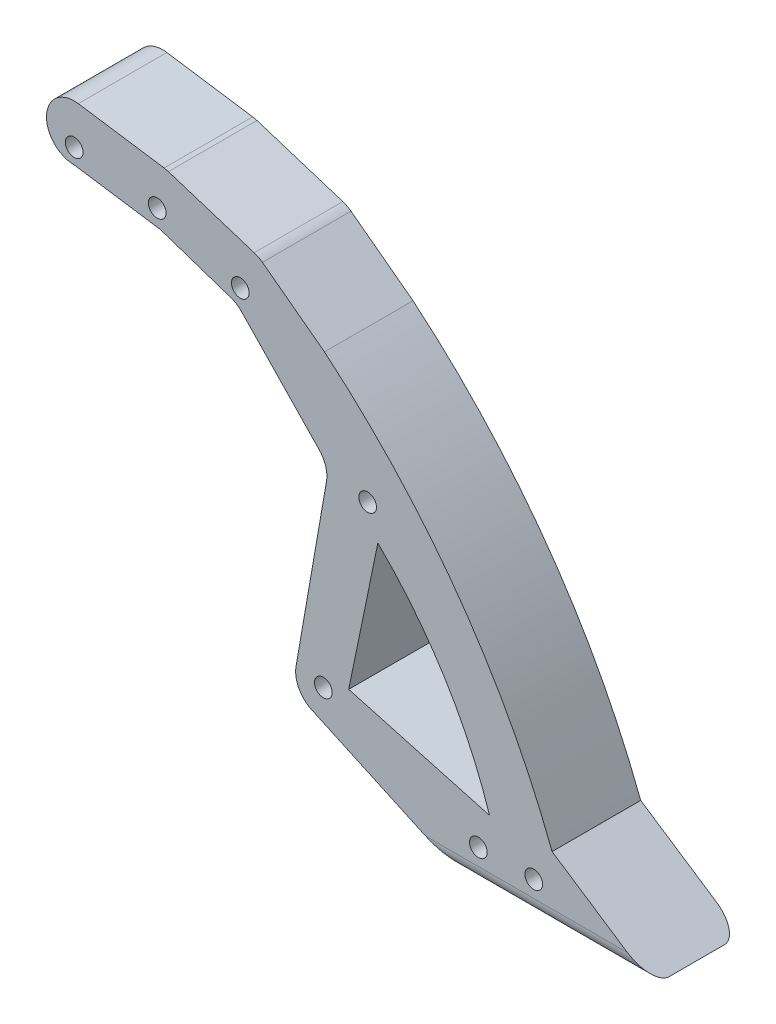
from build123d import *

# Parameters (mm, degrees)
SKETCH1_R           = 1.6
BOSS_EXTRUDE1_DEPTH = 16
FILLET1_R           = 3
FILLET2_R           = 5
CUT_EXTRUDE1_START  = -5.5
SKETCH2_R           = 2.1
SKETCH2_R_2         = 1.6
CUT_EXTRUDE1_DEPTH  = 5
CUT_EXTRUDE2_START  = -4
SKETCH2_4_R         = 1.6
CUT_EXTRUDE2_DEPTH  = 8
FILLET3_R           = 1


with BuildPart() as part:
    # Sketch1 → Boss-Extrude1 (new body)
    with BuildSketch(Plane.XY):
        with BuildLine():
            Line((59.46, -17), (41.32, -5))
            ThreePointArc((41.32, -5), (24.459745553, 26.441207242), (0.2, 52.6))
            Line((0.2, 52.6), (-11, 61))
            ThreePointArc((-11, 61), (-11.709245402, 61.444372101), (-12.482677345, 61.764213677))
            Line((-12.482677345, 61.764213677), (-27.982677345, 66.70070535))
            Line((-27.982677345, 66.70070535), (-28.761883628, 66.881709992))
            Line((-28.761883628, 66.881709992), (-44.261883628, 69.195218319))
            ThreePointArc((-44.261883628, 69.195218319), (-49.986285772, 64.62007324), (-45, 59.25))
            Line((-45, 59.25), (-29.5, 56.936491673))
            Line((-29.5, 56.936491673), (-15.593484906, 52.260716736))
            Line((-15.593484906, 52.260716736), (1, 35))
            Line((1, 35), (-4.926348457, 0.855038527))
            ThreePointArc((-4.926348457, 0.855038527), (-4.425801292, -2.326431372), (-2.089024899, -4.542683675))
            Line((-2.089024899, -4.542683675), (25, -17))
            Line((25, -17), (59.46, -17))
        make_face()
        with Locations((28, -11)):
            Circle(SKETCH1_R, mode=Mode.SUBTRACT)
        with Locations((38, -11)):
            Circle(SKETCH1_R, mode=Mode.SUBTRACT)
        with BuildLine():
            Line((30.019916022, -5), (4.581128304, 2.00331312))
            Line((4.581128304, 2.00331312), (9.851129428, 27.519340358))
            ThreePointArc((9.851129428, 27.519340358), (21.90850327, 12.483330411), (30.019916022, -5))
        make_face(mode=Mode.SUBTRACT)
        with Locations((-45, 62)):
            Circle(SKETCH1_R, mode=Mode.SUBTRACT)
        with Locations((-30, 60)):
            Circle(SKETCH1_R, mode=Mode.SUBTRACT)
        with Locations((-15, 55)):
            Circle(SKETCH1_R, mode=Mode.SUBTRACT)
        with Locations((8, 33)):
            Circle(SKETCH1_R, mode=Mode.SUBTRACT)
        Circle(SKETCH1_R, mode=Mode.SUBTRACT)
    extrude(amount=BOSS_EXTRUDE1_DEPTH)

    # Fillet1
    fillet1_edges = [part.edges().sort_by_distance(p)[0] for p in [
        (42.23, -17, 0),
        (42.23, -17, 16),
    ]]
    fillet(fillet1_edges, radius=FILLET1_R)

    # Fillet2
    fillet2_edges = [part.edges().sort_by_distance(p)[0] for p in [
        (1, 35, 8),
        (-15.593484906, 52.260716736, 8),
        (-29.5, 56.936491673, 8),
    ]]
    fillet(fillet2_edges, radius=FILLET2_R)

    # Sketch2 → Cut-Extrude1 (cut)
    # profile 1 of 3: a face of its own
    with BuildSketch(Plane.XY.offset(16).offset(CUT_EXTRUDE1_START)):
        with BuildLine():
            Line((-23.499613929, 54.918987315), (-16.755150829, 52.651302614))
            ThreePointArc((-16.755150829, 52.651302614), (-15.672698928, 52.135686265), (-14.744120066, 51.377198536))
            Line((-14.744120066, 51.377198536), (-10, 46.442315172))
            Line((-10, 46.442315172), (-10, 55))
            ThreePointArc((-10, 55), (-12.752546223, 59.466424915), (-17.979580608, 59.015233418))
            Line((-17.979580608, 59.015233418), (-23.499613929, 54.918987315))
        make_face()
        with Locations((-15, 55)):
            Circle(SKETCH2_R, mode=Mode.SUBTRACT)
    # profile 2 of 3: a face of its own
    with BuildSketch(Plane.XY.offset(16).offset(CUT_EXTRUDE1_START)):
        with BuildLine():
            Line((-23.499613929, 54.918987315), (-25.163326304, 61.267512349))
            ThreePointArc((-25.163326304, 61.267512349), (-28.762198184, 64.844362359), (-33.635794756, 63.432345625))
            Line((-33.635794756, 63.432345625), (-38.5, 58.279819089))
            Line((-38.5, 58.279819089), (-29.936778714, 57.001684653))
            ThreePointArc((-29.936778714, 57.001684653), (-29.504556057, 56.917567707), (-29.081410179, 56.795749598))
            Line((-29.081410179, 56.795749598), (-23.499613929, 54.918987315))
        make_face()
        with Locations((-30, 60)):
            Circle(SKETCH2_R_2, mode=Mode.SUBTRACT)
    # profile 3 of 3: a face of its own
    with BuildSketch(Plane.XY.offset(16).offset(CUT_EXTRUDE1_START)):
        with BuildLine():
            Line((-38.5, 58.279819089), (-40.253762465, 63.572650394))
            ThreePointArc((-40.253762465, 63.572650394), (-45.2324625, 66.994593195), (-49.871793817, 63.125))
            ThreePointArc((-49.871793817, 63.125), (-48.112474899, 60.336881039), (-45, 59.25))
            Line((-45, 59.25), (-38.5, 58.279819089))
        make_face()
        with Locations((-45, 62)):
            Circle(SKETCH2_R, mode=Mode.SUBTRACT)
    extrude(amount=-CUT_EXTRUDE1_DEPTH, mode=Mode.SUBTRACT)

    # Sketch2<4> → Cut-Extrude2 (cut)
    # profile 1 of 3: a face of its own
    with BuildSketch(Plane.XY.offset(16).offset(CUT_EXTRUDE2_START)):
        with BuildLine():
            Line((-16.799757531, 56.082068773), (-18.50808127, 53.240688824))
            Line((-18.50808127, 53.240688824), (-16.755150829, 52.651302614))
            ThreePointArc((-16.755150829, 52.651302614), (-15.672698928, 52.135686265), (-14.744120066, 51.377198536))
            Line((-14.744120066, 51.377198536), (-13.205359072, 53.909466214))
            ThreePointArc((-13.205359072, 53.909466214), (-13.913695708, 56.797204214), (-16.799757531, 56.082068773))
        make_face()
        with Locations((-15, 55)):
            Circle(SKETCH2_4_R, mode=Mode.SUBTRACT)
    # profile 2 of 3: a face of its own
    with BuildSketch(Plane.XY.offset(16).offset(CUT_EXTRUDE2_START)):
        with BuildLine():
            Line((-29.081410179, 56.795749598), (-28.352112311, 56.550538438))
            Line((-28.352112311, 56.550538438), (-27.919359393, 59.715509815))
            ThreePointArc((-27.919359393, 59.715509815), (-29.718455545, 62.081041259), (-32.08143774, 60.27859816))
            Line((-32.08143774, 60.27859816), (-32.469451039, 57.379707783))
            Line((-32.469451039, 57.379707783), (-29.936778714, 57.001684653))
            ThreePointArc((-29.936778714, 57.001684653), (-29.504556057, 56.917567707), (-29.081410179, 56.795749598))
        make_face()
        with Locations((-30, 60)):
            Circle(SKETCH2_4_R, mode=Mode.SUBTRACT)
    # profile 3 of 3: a face of its own
    with BuildSketch(Plane.XY.offset(16).offset(CUT_EXTRUDE2_START)):
        with BuildLine():
            Line((-45, 59.25), (-43.396661475, 59.010687934))
            Line((-43.396661475, 59.010687934), (-42.932168542, 61.633840116))
            ThreePointArc((-42.932168542, 61.633840116), (-44.635424811, 64.068111441), (-47.068390209, 62.36299028))
            Line((-47.068390209, 62.36299028), (-47.497405572, 59.918376123))
            ThreePointArc((-47.497405572, 59.918376123), (-46.292648563, 59.419983469), (-45, 59.25))
        make_face()
        with Locations((-45, 62)):
            Circle(SKETCH2_4_R, mode=Mode.SUBTRACT)
    extrude(amount=-CUT_EXTRUDE2_DEPTH, mode=Mode.SUBTRACT)

    # Fillet3
    fillet3_edges = [part.edges().sort_by_distance(p)[0] for p in [
        (-14.744120066, 51.377198536, 4.75),
        (-14.744120066, 51.377198536, 11.25),
        (-18.50808127, 53.240688824, 11.25),
        (-18.50808127, 53.240688824, 4.75),
        (-43.396661475, 59.010687934, 11.25),
        (-47.497405572, 59.918376123, 11.25),
        (-43.396661475, 59.010687934, 4.75),
        (-47.497405572, 59.918376123, 4.75),
        (-28.352112311, 56.550538438, 11.25),
        (-32.469451039, 57.379707783, 11.25),
        (-28.352112311, 56.550538438, 4.75),
        (-32.469451039, 57.379707783, 4.75),
    ]]
    fillet(fillet3_edges, radius=FILLET3_R)


solid = part.part
